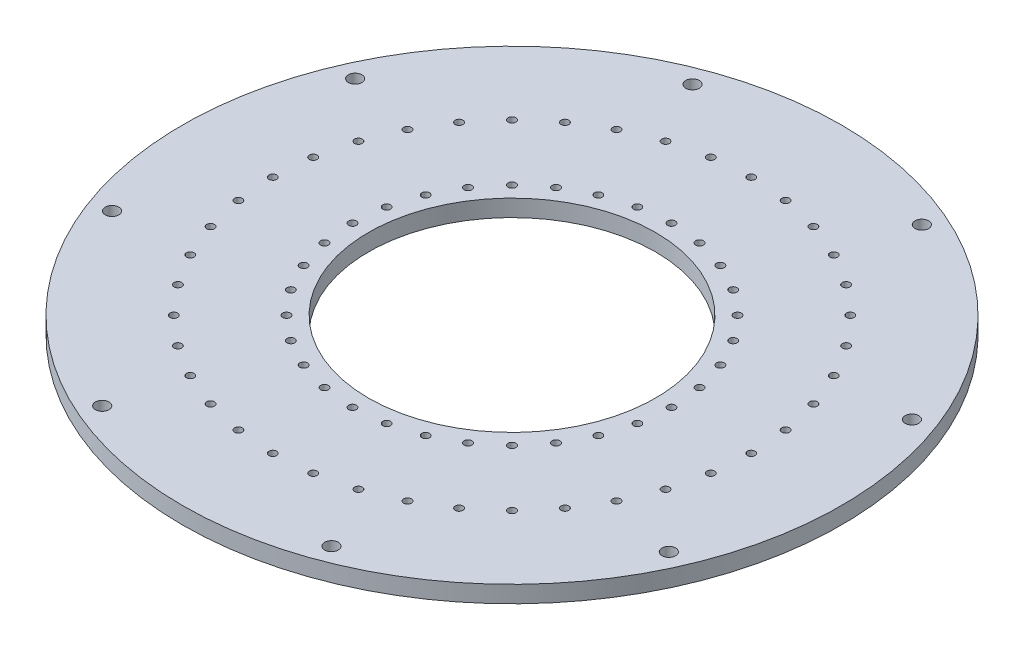
from build123d import *

# Parameters (mm, degrees)
SKETCH1_R           = 124
BOSS_EXTRUDE1_DEPTH = 6.35
SKETCH6_R           = 2.5527
CUT_EXTRUDE1_DEPTH  = 176.477413076
SKETCH8_R           = 11
CUT_EXTRUDE3_DEPTH  = 176.477413076
SKETCH9_R           = 2.45
CUT_EXTRUDE4_DEPTH  = 176.477413076
SKETCH12_R          = 1.45
CUT_EXTRUDE5_DEPTH  = 176.477413076
SKETCH13_R          = 54
CUT_EXTRUDE6_DEPTH  = 176.477413076


with BuildPart() as part:
    # Sketch1 → Boss-Extrude1 (new body)
    with BuildSketch(Plane(origin=(0, 0, 0), x_dir=(1, 0, 0), z_dir=(0, 1, 0))):
        with Locations(Location((0, 0, 0), (0, 0, 270))):
            Circle(SKETCH1_R)
    extrude(amount=BOSS_EXTRUDE1_DEPTH)

    # Sketch6 → Cut-Extrude1 (cut, through all)
    with BuildSketch(Plane.XZ):
        with Locations(Location((-109.204648421, 41.27165811, 0), (0, 0, 270))):
            Circle(SKETCH6_R)
        with Locations(Location((-106.602870566, -47.590261473, 0), (0, 0, 270))):
            Circle(SKETCH6_R)
        with Locations(Location((109.204648421, -41.27165811, 0), (0, 0, 270))):
            Circle(SKETCH6_R)
        with Locations(Location((106.602870566, 47.590261473, 0), (0, 0, 270))):
            Circle(SKETCH6_R)
        with Locations(Location((41.27165811, 109.204648421, 0), (0, 0, 270))):
            Circle(SKETCH6_R)
        with Locations(Location((-47.590261473, 106.602870566, 0), (0, 0, 270))):
            Circle(SKETCH6_R)
        with Locations(Location((-41.27165811, -109.204648421, 0), (0, 0, 270))):
            Circle(SKETCH6_R)
        with Locations(Location((47.590261473, -106.602870566, 0), (0, 0, 270))):
            Circle(SKETCH6_R)
    extrude(amount=-CUT_EXTRUDE1_DEPTH, mode=Mode.SUBTRACT)

    # Sketch8 → Cut-Extrude3 (cut, through all)
    with BuildSketch(Plane(origin=(0, 6.35, 0), x_dir=(1, 0, 0), z_dir=(0, 1, 0))):
        with Locations(Location((0, 0, 0), (0, 0, 270))):
            Circle(SKETCH8_R)
    extrude(amount=-CUT_EXTRUDE3_DEPTH, mode=Mode.SUBTRACT)

    # Sketch9 → Cut-Extrude4 (cut, through all)
    with BuildSketch(Plane(origin=(0, 6.35, 0), x_dir=(1, 0, 0), z_dir=(0, 1, 0))):
        with Locations(Location((-15.112143296, -8.725, 0), (0, 0, 270))):
            Circle(SKETCH9_R)
        with Locations(Location((0, 17.45, 0), (0, 0, 270))):
            Circle(SKETCH9_R)
        with Locations(Location((15.112143296, -8.725, 0), (0, 0, 270))):
            Circle(SKETCH9_R)
    extrude(amount=-CUT_EXTRUDE4_DEPTH, mode=Mode.SUBTRACT)

    # Sketch12 → Cut-Extrude5 (cut, through all)
    with BuildSketch(Plane(origin=(0, 6.35, 0), x_dir=(1, 0, 0), z_dir=(0, 1, 0))):
        with Locations(Location((0, 30, 0), (0, 0, 270))):
            Circle(SKETCH12_R)
        with Locations(Location((0, 60, 0), (0, 0, 270))):
            Circle(SKETCH12_R)
        with Locations(Location((0, 90, 0), (0, 0, 270))):
            Circle(SKETCH12_R)
        with Locations(Location((11.480502971, 27.716385975, 0), (0, 0, 270))):
            Circle(SKETCH12_R)
        with Locations(Location((21.213203436, 21.213203436, 0), (0, 0, 270))):
            Circle(SKETCH12_R)
        with Locations(Location((27.716385975, 11.480502971, 0), (0, 0, 270))):
            Circle(SKETCH12_R)
        with Locations(Location((30, 0, 0), (0, 0, 270))):
            Circle(SKETCH12_R)
        with Locations(Location((27.716385975, -11.480502971, 0), (0, 0, 270))):
            Circle(SKETCH12_R)
        with Locations(Location((21.213203436, -21.213203436, 0), (0, 0, 270))):
            Circle(SKETCH12_R)
        with Locations(Location((11.480502971, -27.716385975, 0), (0, 0, 270))):
            Circle(SKETCH12_R)
        with Locations(Location((0, -30, 0), (0, 0, 270))):
            Circle(SKETCH12_R)
        with Locations(Location((-11.480502971, -27.716385975, 0), (0, 0, 270))):
            Circle(SKETCH12_R)
        with Locations(Location((-21.213203436, -21.213203436, 0), (0, 0, 270))):
            Circle(SKETCH12_R)
        with Locations(Location((-27.716385975, -11.480502971, 0), (0, 0, 270))):
            Circle(SKETCH12_R)
        with Locations(Location((-30, 0, 0), (0, 0, 270))):
            Circle(SKETCH12_R)
        with Locations(Location((-27.716385975, 11.480502971, 0), (0, 0, 270))):
            Circle(SKETCH12_R)
        with Locations(Location((-21.213203436, 21.213203436, 0), (0, 0, 270))):
            Circle(SKETCH12_R)
        with Locations(Location((-11.480502971, 27.716385975, 0), (0, 0, 270))):
            Circle(SKETCH12_R)
        with Locations(Location((11.705419321, 58.847116824, 0), (0, 0, 270))):
            Circle(SKETCH12_R)
        with Locations(Location((22.961005942, 55.432771951, 0), (0, 0, 270))):
            Circle(SKETCH12_R)
        with Locations(Location((33.334213981, 49.888176738, 0), (0, 0, 270))):
            Circle(SKETCH12_R)
        with Locations(Location((42.426406871, 42.426406871, 0), (0, 0, 270))):
            Circle(SKETCH12_R)
        with Locations(Location((49.888176738, 33.334213981, 0), (0, 0, 270))):
            Circle(SKETCH12_R)
        with Locations(Location((55.432771951, 22.961005942, 0), (0, 0, 270))):
            Circle(SKETCH12_R)
        with Locations(Location((58.847116824, 11.705419321, 0), (0, 0, 270))):
            Circle(SKETCH12_R)
        with Locations(Location((60, 0, 0), (0, 0, 270))):
            Circle(SKETCH12_R)
        with Locations(Location((58.847116824, -11.705419321, 0), (0, 0, 270))):
            Circle(SKETCH12_R)
        with Locations(Location((55.432771951, -22.961005942, 0), (0, 0, 270))):
            Circle(SKETCH12_R)
        with Locations(Location((49.888176738, -33.334213981, 0), (0, 0, 270))):
            Circle(SKETCH12_R)
        with Locations(Location((42.426406871, -42.426406871, 0), (0, 0, 270))):
            Circle(SKETCH12_R)
        with Locations(Location((33.334213981, -49.888176738, 0), (0, 0, 270))):
            Circle(SKETCH12_R)
        with Locations(Location((22.961005942, -55.432771951, 0), (0, 0, 270))):
            Circle(SKETCH12_R)
        with Locations(Location((11.705419321, -58.847116824, 0), (0, 0, 270))):
            Circle(SKETCH12_R)
        with Locations(Location((0, -60, 0), (0, 0, 270))):
            Circle(SKETCH12_R)
        with Locations(Location((-11.705419321, -58.847116824, 0), (0, 0, 270))):
            Circle(SKETCH12_R)
        with Locations(Location((-22.961005942, -55.432771951, 0), (0, 0, 270))):
            Circle(SKETCH12_R)
        with Locations(Location((-33.334213981, -49.888176738, 0), (0, 0, 270))):
            Circle(SKETCH12_R)
        with Locations(Location((-42.426406871, -42.426406871, 0), (0, 0, 270))):
            Circle(SKETCH12_R)
        with Locations(Location((-49.888176738, -33.334213981, 0), (0, 0, 270))):
            Circle(SKETCH12_R)
        with Locations(Location((-55.432771951, -22.961005942, 0), (0, 0, 270))):
            Circle(SKETCH12_R)
        with Locations(Location((-58.847116824, -11.705419321, 0), (0, 0, 270))):
            Circle(SKETCH12_R)
        with Locations(Location((-60, 0, 0), (0, 0, 270))):
            Circle(SKETCH12_R)
        with Locations(Location((-58.847116824, 11.705419321, 0), (0, 0, 270))):
            Circle(SKETCH12_R)
        with Locations(Location((-55.432771951, 22.961005942, 0), (0, 0, 270))):
            Circle(SKETCH12_R)
        with Locations(Location((-49.888176738, 33.334213981, 0), (0, 0, 270))):
            Circle(SKETCH12_R)
        with Locations(Location((-42.426406871, 42.426406871, 0), (0, 0, 270))):
            Circle(SKETCH12_R)
        with Locations(Location((-33.334213981, 49.888176738, 0), (0, 0, 270))):
            Circle(SKETCH12_R)
        with Locations(Location((-22.961005942, 55.432771951, 0), (0, 0, 270))):
            Circle(SKETCH12_R)
        with Locations(Location((-11.705419321, 58.847116824, 0), (0, 0, 270))):
            Circle(SKETCH12_R)
        with Locations(Location((14.079101854, 88.891950654, 0), (0, 0, 270))):
            Circle(SKETCH12_R)
        with Locations(Location((27.811529494, 85.595086467, 0), (0, 0, 270))):
            Circle(SKETCH12_R)
        with Locations(Location((40.859144977, 80.190587177, 0), (0, 0, 270))):
            Circle(SKETCH12_R)
        with Locations(Location((52.900672706, 72.811529494, 0), (0, 0, 270))):
            Circle(SKETCH12_R)
        with Locations(Location((63.639610307, 63.639610307, 0), (0, 0, 270))):
            Circle(SKETCH12_R)
        with Locations(Location((72.811529494, 52.900672706, 0), (0, 0, 270))):
            Circle(SKETCH12_R)
        with Locations(Location((80.190587177, 40.859144977, 0), (0, 0, 270))):
            Circle(SKETCH12_R)
        with Locations(Location((85.595086467, 27.811529494, 0), (0, 0, 270))):
            Circle(SKETCH12_R)
        with Locations(Location((88.891950654, 14.079101854, 0), (0, 0, 270))):
            Circle(SKETCH12_R)
        with Locations(Location((90, 0, 0), (0, 0, 270))):
            Circle(SKETCH12_R)
        with Locations(Location((88.891950654, -14.079101854, 0), (0, 0, 270))):
            Circle(SKETCH12_R)
        with Locations(Location((85.595086467, -27.811529494, 0), (0, 0, 270))):
            Circle(SKETCH12_R)
        with Locations(Location((80.190587177, -40.859144977, 0), (0, 0, 270))):
            Circle(SKETCH12_R)
        with Locations(Location((72.811529494, -52.900672706, 0), (0, 0, 270))):
            Circle(SKETCH12_R)
        with Locations(Location((63.639610307, -63.639610307, 0), (0, 0, 270))):
            Circle(SKETCH12_R)
        with Locations(Location((52.900672706, -72.811529494, 0), (0, 0, 270))):
            Circle(SKETCH12_R)
        with Locations(Location((40.859144977, -80.190587177, 0), (0, 0, 270))):
            Circle(SKETCH12_R)
        with Locations(Location((27.811529494, -85.595086467, 0), (0, 0, 270))):
            Circle(SKETCH12_R)
        with Locations(Location((14.079101854, -88.891950654, 0), (0, 0, 270))):
            Circle(SKETCH12_R)
        with Locations(Location((0, -90, 0), (0, 0, 270))):
            Circle(SKETCH12_R)
        with Locations(Location((-14.079101854, -88.891950654, 0), (0, 0, 270))):
            Circle(SKETCH12_R)
        with Locations(Location((-27.811529494, -85.595086467, 0), (0, 0, 270))):
            Circle(SKETCH12_R)
        with Locations(Location((-40.859144977, -80.190587177, 0), (0, 0, 270))):
            Circle(SKETCH12_R)
        with Locations(Location((-52.900672706, -72.811529494, 0), (0, 0, 270))):
            Circle(SKETCH12_R)
        with Locations(Location((-63.639610307, -63.639610307, 0), (0, 0, 270))):
            Circle(SKETCH12_R)
        with Locations(Location((-72.811529494, -52.900672706, 0), (0, 0, 270))):
            Circle(SKETCH12_R)
        with Locations(Location((-80.190587177, -40.859144977, 0), (0, 0, 270))):
            Circle(SKETCH12_R)
        with Locations(Location((-85.595086467, -27.811529494, 0), (0, 0, 270))):
            Circle(SKETCH12_R)
        with Locations(Location((-88.891950654, -14.079101854, 0), (0, 0, 270))):
            Circle(SKETCH12_R)
        with Locations(Location((-90, 0, 0), (0, 0, 270))):
            Circle(SKETCH12_R)
        with Locations(Location((-88.891950654, 14.079101854, 0), (0, 0, 270))):
            Circle(SKETCH12_R)
        with Locations(Location((-85.595086467, 27.811529494, 0), (0, 0, 270))):
            Circle(SKETCH12_R)
        with Locations(Location((-80.190587177, 40.859144977, 0), (0, 0, 270))):
            Circle(SKETCH12_R)
        with Locations(Location((-72.811529494, 52.900672706, 0), (0, 0, 270))):
            Circle(SKETCH12_R)
        with Locations(Location((-63.639610307, 63.639610307, 0), (0, 0, 270))):
            Circle(SKETCH12_R)
        with Locations(Location((-52.900672706, 72.811529494, 0), (0, 0, 270))):
            Circle(SKETCH12_R)
        with Locations(Location((-40.859144977, 80.190587177, 0), (0, 0, 270))):
            Circle(SKETCH12_R)
        with Locations(Location((-27.811529494, 85.595086467, 0), (0, 0, 270))):
            Circle(SKETCH12_R)
        with Locations(Location((-14.079101854, 88.891950654, 0), (0, 0, 270))):
            Circle(SKETCH12_R)
    extrude(amount=-CUT_EXTRUDE5_DEPTH, mode=Mode.SUBTRACT)

    # Sketch13 → Cut-Extrude6 (cut, through all)
    with BuildSketch(Plane(origin=(0, 6.35, 0), x_dir=(1, 0, 0), z_dir=(0, 1, 0))):
        with Locations(Location((0, 0, 0), (0, 0, 270))):
            Circle(SKETCH13_R)
    extrude(amount=-CUT_EXTRUDE6_DEPTH, mode=Mode.SUBTRACT)


solid = part.part
